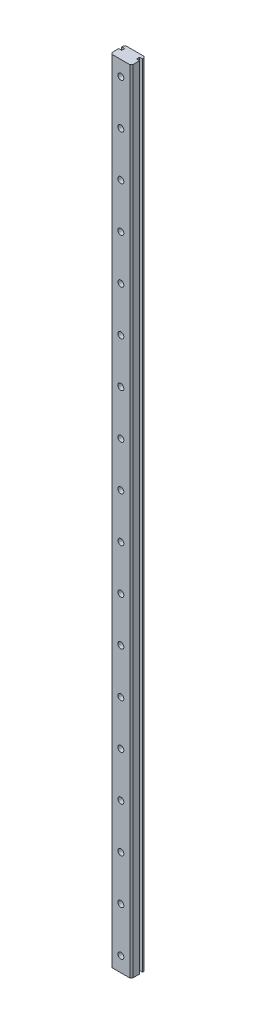
from build123d import *

# Parameters (mm, degrees)
EXTRUDE_1_DEPTH     = 265
SKETCH_2_R          = 1
CUT_EXTRUDE_1_DEPTH = 10
CHAMFER_1_SIZE      = 0.5
SKETCH_3_R          = 2.383304988
CUT_EXTRUDE_2_DEPTH = 1


with BuildPart() as part:
    # 草图1 → 凸台-拉伸1 (new body)
    with BuildSketch(Plane(origin=(0, 0, 0), x_dir=(1, 0, 0), z_dir=(0, 1, 0))):
        Polygon((-3.5, 0.4), (-3.5, -2.4), (3.5, -2.4), (3.5, 0.4), (2.5, 0.4), (2.5, 1.4), (3.5, 1.4), (3.5, 2.4), (-3.5, 2.4), (-3.5, 1.4), (-2.5, 1.4), (-2.5, 0.4), align=None)
    extrude(amount=EXTRUDE_1_DEPTH)

    # 草图2 → 切除-拉伸1 (cut)
    with BuildSketch(Plane(origin=(0, 0, -2.4), x_dir=(-1, 0, 0), z_dir=(0, 0, -1))):
        with Locations((0, 5)):
            Circle(SKETCH_2_R)
        with Locations((0, 20)):
            Circle(SKETCH_2_R)
        with Locations((0, 35)):
            Circle(SKETCH_2_R)
        with Locations((0, 50)):
            Circle(SKETCH_2_R)
        with Locations((0, 65)):
            Circle(SKETCH_2_R)
        with Locations((0, 80)):
            Circle(SKETCH_2_R)
        with Locations((0, 95)):
            Circle(SKETCH_2_R)
        with Locations((0, 110)):
            Circle(SKETCH_2_R)
        with Locations((0, 125)):
            Circle(SKETCH_2_R)
        with Locations((0, 140)):
            Circle(SKETCH_2_R)
        with Locations((0, 155)):
            Circle(SKETCH_2_R)
        with Locations((0, 170)):
            Circle(SKETCH_2_R)
        with Locations((0, 185)):
            Circle(SKETCH_2_R)
        with Locations((0, 200)):
            Circle(SKETCH_2_R)
        with Locations((0, 215)):
            Circle(SKETCH_2_R)
        with Locations((0, 230)):
            Circle(SKETCH_2_R)
        with Locations((0, 245)):
            Circle(SKETCH_2_R)
        with Locations((0, 260)):
            Circle(SKETCH_2_R)
    extrude(amount=-CUT_EXTRUDE_1_DEPTH, mode=Mode.SUBTRACT)

    # 倒角1
    chamfer_1_edges = [part.edges().sort_by_distance(p)[0] for p in [
        (-3.5, 132.5, -2.4),
        (3.5, 132.5, -2.4),
        (3.5, 132.5, 2.4),
        (-3.5, 132.5, 2.4),
    ]]
    chamfer(chamfer_1_edges, length=CHAMFER_1_SIZE)

    # 草图3 → 切除-拉伸2 (cut)
    with BuildSketch(Plane(origin=(0, 0, -2.4), x_dir=(-1, 0, 0), z_dir=(0, 0, -1))):
        with Locations((0, 5)):
            Circle(SKETCH_3_R)
        with Locations((0, 20)):
            Circle(SKETCH_3_R)
        with Locations((0, 35)):
            Circle(SKETCH_3_R)
        with Locations((0, 50)):
            Circle(SKETCH_3_R)
        with Locations((0, 65)):
            Circle(SKETCH_3_R)
        with Locations((0, 80)):
            Circle(SKETCH_3_R)
        with Locations((0, 95)):
            Circle(SKETCH_3_R)
        with Locations((0, 110)):
            Circle(SKETCH_3_R)
        with Locations((0, 125)):
            Circle(SKETCH_3_R)
        with Locations((0, 140)):
            Circle(SKETCH_3_R)
        with Locations((0, 155)):
            Circle(SKETCH_3_R)
        with Locations((0, 170)):
            Circle(SKETCH_3_R)
        with Locations((0, 185)):
            Circle(SKETCH_3_R)
        with Locations((0, 200)):
            Circle(SKETCH_3_R)
        with Locations((0, 215)):
            Circle(SKETCH_3_R)
        with Locations((0, 230)):
            Circle(SKETCH_3_R)
        with Locations((0, 245)):
            Circle(SKETCH_3_R)
        with Locations((0, 260)):
            Circle(SKETCH_3_R)
    extrude(amount=-CUT_EXTRUDE_2_DEPTH, mode=Mode.SUBTRACT)


solid = part.part
